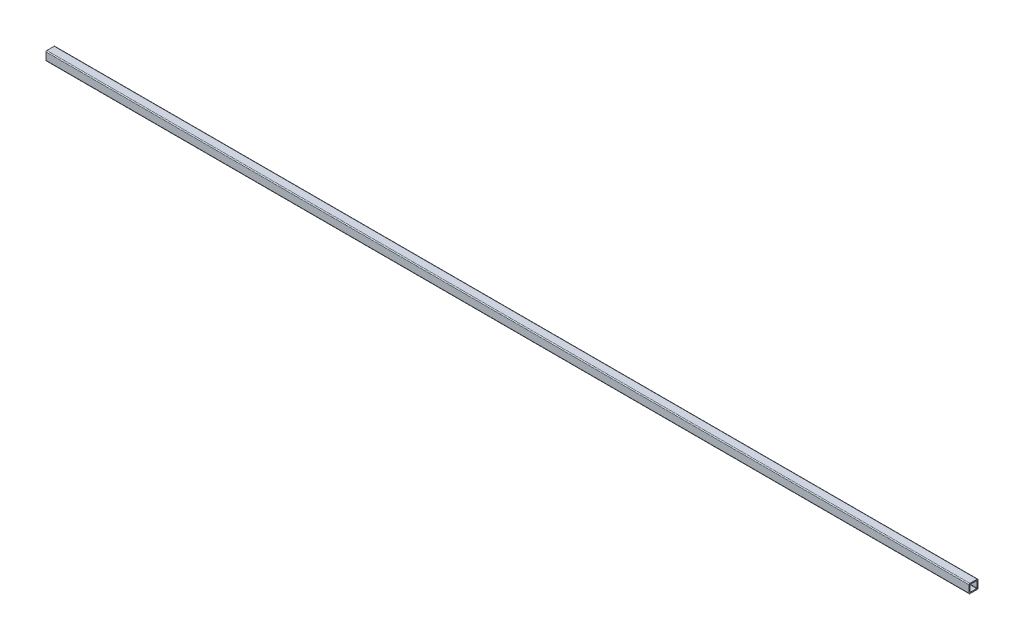
from build123d import *

# Parameters (mm, degrees)
SKETCH3_W           = 25.4
SKETCH3_H           = 25.4
SKETCH3_W_2         = 19.304
SKETCH3_H_2         = 19.304
BOSS_EXTRUDE1_DEPTH = 2610
FILLET1_R           = 2.5
FILLET2_R           = 1


with BuildPart() as part:
    # Sketch3 → Boss-Extrude1 (new body)
    with BuildSketch(Plane(origin=(0, 0, 0), x_dir=(0, 0, -1), z_dir=(1, 0, 0))):
        Rectangle(SKETCH3_W, SKETCH3_H)
        Rectangle(SKETCH3_W_2, SKETCH3_H_2, mode=Mode.SUBTRACT)
    extrude(amount=-BOSS_EXTRUDE1_DEPTH)

    # Fillet1
    fillet1_edges = [part.edges().sort_by_distance(p)[0] for p in [
        (-1305, -12.7, -12.7),
        (-1305, -12.7, 12.7),
        (-1305, 12.7, 12.7),
        (-1305, 12.7, -12.7),
    ]]
    fillet(fillet1_edges, radius=FILLET1_R)

    # Fillet2
    fillet2_edges = [part.edges().sort_by_distance(p)[0] for p in [
        (-1305, 9.652, -9.652),
        (-1305, -9.652, -9.652),
        (-1305, -9.652, 9.652),
        (-1305, 9.652, 9.652),
    ]]
    fillet(fillet2_edges, radius=FILLET2_R)


solid = part.part
